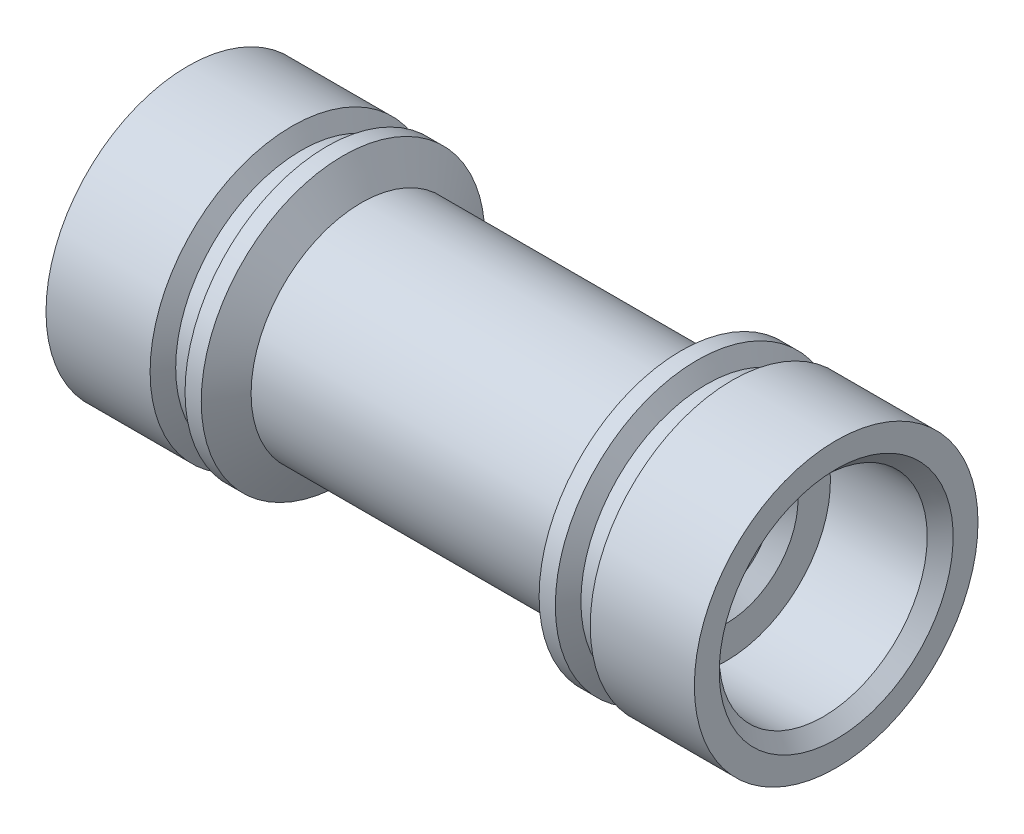
from build123d import *

# Parameters (mm, degrees)
CHAMFER1_SIZE = 0.508


with BuildPart() as part:
    # Sketch2 → Revolve1 (revolve)
    with BuildSketch(Plane.XY, mode=Mode.PRIVATE) as revolve1_sk:
        Polygon((-8.621617421, 5.55625), (-12.7, 5.55625), (-12.7, 4.075), (-8.399999964, 4.075), (-8.399999964, 2.805), (-7.891999964, 2.297), (-7.891999964, 1.905), (-2.748, 1.905), (-0.843, 0), (0, 0), (0, 4.318), (-5.903478608, 4.318), (-6.618382579, 5.55625), (-7.253382579, 5.55625), (-7.62, 4.92125), (-8.255, 4.92125), align=None)
    revolve(revolve1_sk.sketch.rotate(Axis((-12.7, 0, 0), (1, 0, 0)), 180), axis=Axis((-12.7, 0, 0), (1, 0, 0)))

    # Chamfer1
    chamfer1_edges = [part.edges().sort_by_distance(p)[0] for p in [
        (-12.7, 4.075, 0),
    ]]
    chamfer(chamfer1_edges, length=CHAMFER1_SIZE)

    # Mirror1: part across plane


with BuildPart() as part_1:
    add(part.part)
    add(part.part.mirror(Plane(origin=(0, 0, 0), x_dir=(0, 0, 1), z_dir=(1, 0, 0))))


solid = part_1.part
